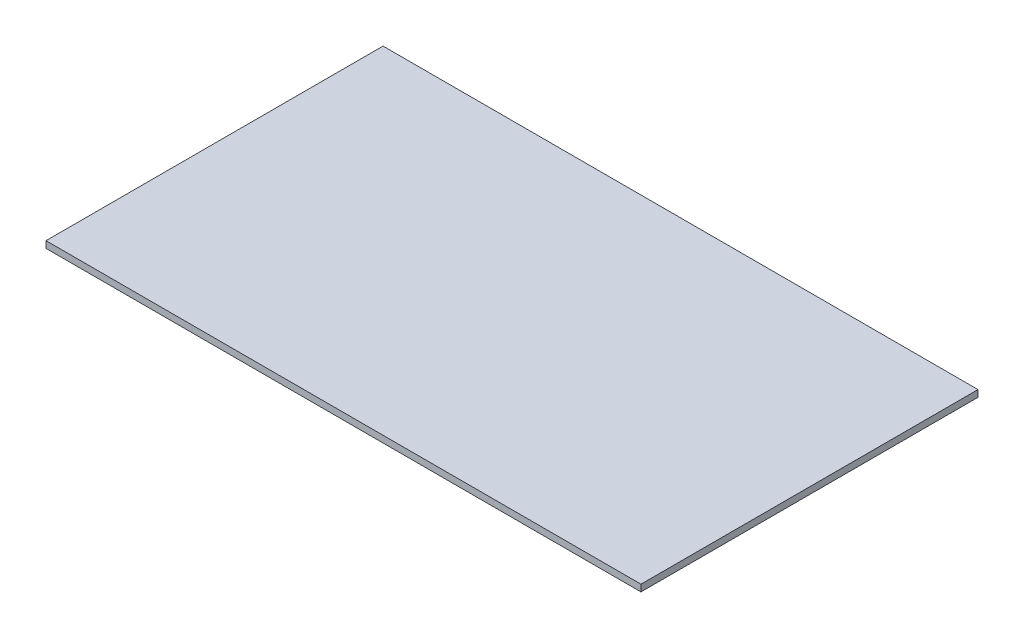
from build123d import *

# Parameters (mm, degrees)
SKETCH1_W           = 88.58
SKETCH1_H           = 50.18
BOSS_EXTRUDE1_DEPTH = 1


with BuildPart() as part:
    # Sketch1 → Boss-Extrude1 (new body)
    with BuildSketch(Plane(origin=(0, 0, 0), x_dir=(1, 0, 0), z_dir=(0, 1, 0))):
        Rectangle(SKETCH1_W, SKETCH1_H)
    extrude(amount=BOSS_EXTRUDE1_DEPTH)


solid = part.part
